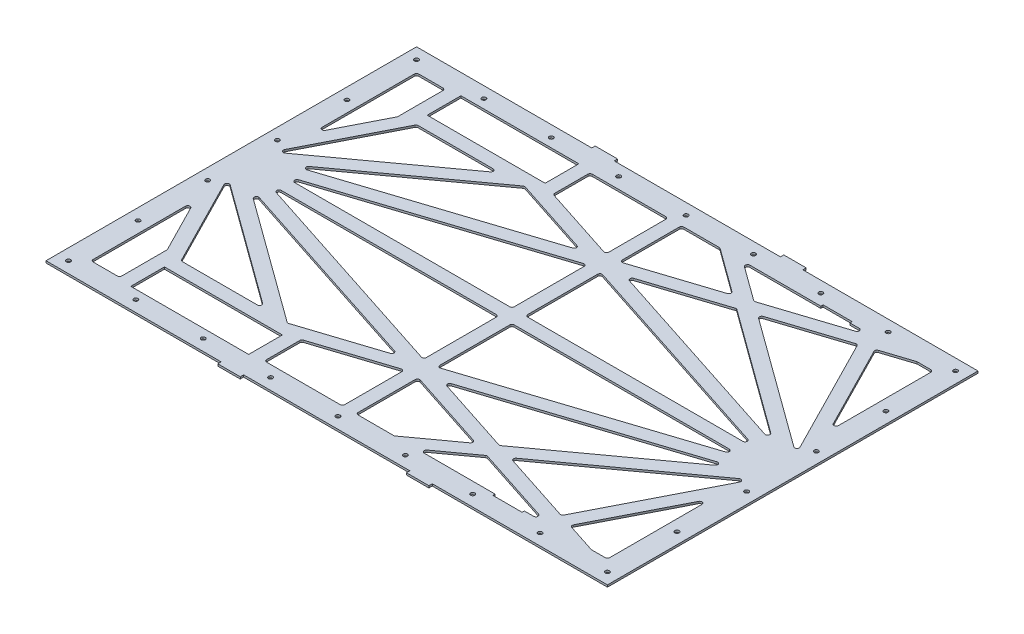
from build123d import *

# Parameters (mm, degrees)
SKETCH1_W               = 635
SKETCH1_H               = 419.1
BOSS_EXTRUDE1_DEPTH     = 2.286
SKETCH2_W               = 133.35
SKETCH2_H               = 38.1
CUT_EXTRUDE1_DEPTH      = 381.424339779
CUT_EXTRUDE2_DEPTH      = 381.424339779
SKETCH5_W               = 33.02
SKETCH5_H               = 2.54
CUT_EXTRUDE3_DEPTH      = 2.54
SKETCH8_W               = 25.4
SKETCH8_H               = 3.81
BOSS_EXTRUDE3_DEPTH     = 2.286
MIRROR5_COPY_1_SKETCH_W = 25.4
MIRROR5_COPY_1_SKETCH_H = 3.81
MIRROR5_COPY_1_DEPTH    = 2.286
SKETCH9_R               = 2.38125
CUT_EXTRUDE5_DEPTH      = 2.54
LPATTERN1_COUNT         = 9
LPATTERN1_PITCH         = 76.2
LPATTERN2_COUNT         = 9
LPATTERN2_PITCH         = 78.74
MIRROR6_COPY_1_SKETCH_R = 2.38125
MIRROR6_COPY_1_DEPTH    = 2.54
MIRROR6_COPY_2_SKETCH_R = 2.38125
MIRROR6_COPY_2_DEPTH    = 2.54
MIRROR6_COPY_3_SKETCH_R = 2.38125
MIRROR6_COPY_3_DEPTH    = 2.54
MIRROR6_COPY_4_SKETCH_R = 2.38125
MIRROR6_COPY_4_DEPTH    = 2.54
MIRROR6_COPY_5_SKETCH_R = 2.38125
MIRROR6_COPY_5_DEPTH    = 2.54
MIRROR6_COPY_6_SKETCH_R = 2.38125
MIRROR6_COPY_6_DEPTH    = 2.54
MIRROR6_COPY_7_SKETCH_R = 2.38125
MIRROR6_COPY_7_DEPTH    = 2.54
MIRROR6_COPY_8_SKETCH_R = 2.38125
MIRROR6_COPY_8_DEPTH    = 2.54
MIRROR6_COPY_9_SKETCH_R = 2.38125
MIRROR6_COPY_9_DEPTH    = 2.54
MIRROR7_COPY_1_SKETCH_R = 2.38125
MIRROR7_COPY_1_DEPTH    = 2.54
MIRROR7_COPY_2_SKETCH_R = 2.38125
MIRROR7_COPY_2_DEPTH    = 2.54
MIRROR7_COPY_3_SKETCH_R = 2.38125
MIRROR7_COPY_3_DEPTH    = 2.54
MIRROR7_COPY_4_SKETCH_R = 2.38125
MIRROR7_COPY_4_DEPTH    = 2.54
MIRROR7_COPY_5_SKETCH_R = 2.38125
MIRROR7_COPY_5_DEPTH    = 2.54
MIRROR7_COPY_6_SKETCH_R = 2.38125
MIRROR7_COPY_6_DEPTH    = 2.54
MIRROR7_COPY_7_SKETCH_R = 2.38125
MIRROR7_COPY_7_DEPTH    = 2.54
MIRROR7_COPY_8_SKETCH_R = 2.38125
MIRROR7_COPY_8_DEPTH    = 2.54
MIRROR7_COPY_9_SKETCH_R = 2.38125
MIRROR7_COPY_9_DEPTH    = 2.54


with BuildPart() as part:
    # Sketch1 → Boss-Extrude1 (new body)
    with BuildSketch(Plane(origin=(0, 0, 0), x_dir=(1, 0, 0), z_dir=(0, 1, 0))):
        Rectangle(SKETCH1_W, SKETCH1_H)
    extrude(amount=BOSS_EXTRUDE1_DEPTH)

    # Sketch2 → Cut-Extrude1 (cut, through all)
    with BuildSketch(Plane(origin=(0, 2.286, 0), x_dir=(1, 0, 0), z_dir=(0, 1, 0))):
        with Locations((-177.8, -167.64)):
            Rectangle(SKETCH2_W, SKETCH2_H)
        with Locations((-177.8, 167.64)):
            Rectangle(SKETCH2_W, SKETCH2_H)
    extrude(amount=-CUT_EXTRUDE1_DEPTH, mode=Mode.SUBTRACT)

    # Sketch4 → Cut-Extrude2 (cut, through all)
    with BuildSketch(Plane(origin=(0, 2.286, 0), x_dir=(1, 0, 0), z_dir=(0, 1, 0))):
        with BuildLine():
            Line((-289.56, -184.15), (-262.255, -184.15))
            ThreePointArc((-262.255, -184.15), (-260.458948776, -183.406051224), (-259.715, -181.61))
            Line((-259.715, -181.61), (-259.715, -130.803740305))
            ThreePointArc((-259.715, -130.803740305), (-259.785180402, -130.210789081), (-259.991843429, -129.650604435))
            Line((-259.991843429, -129.650604435), (-287.296843429, -76.061524583))
            ThreePointArc((-287.296843429, -76.061524583), (-290.152951224, -74.744840854), (-292.1, -77.214660452))
            Line((-292.1, -77.214660452), (-292.1, -181.61))
            ThreePointArc((-292.1, -181.61), (-291.356051224, -183.406051224), (-289.56, -184.15))
        make_face()
        with BuildLine():
            Line((-154.740705409, -133.35), (-239.446141377, -133.35))
            ThreePointArc((-239.446141377, -133.35), (-240.773287732, -132.975706017), (-241.709297949, -131.963135869))
            Line((-241.709297949, -131.963135869), (-291.497904, -34.247494579))
            ThreePointArc((-291.497904, -34.247494579), (-290.884345471, -31.162927557), (-287.741772888, -31.039455544))
            Line((-287.741772888, -31.039455544), (-153.247730868, -128.755096834))
            ThreePointArc((-153.247730868, -128.755096834), (-152.325021857, -131.594903166), (-154.740705409, -133.35))
        make_face()
        with BuildLine():
            Line((-32.093547486, -105.577687105), (-118.70550908, -133.719619357))
            ThreePointArc((-118.70550908, -133.719619357), (-119.887755787, -133.81266419), (-120.983386786, -133.358838971))
            Line((-120.983386786, -133.358838971), (-261.124484477, -31.540371577))
            ThreePointArc((-261.124484477, -31.540371577), (-261.894666508, -28.332332542), (-258.846606771, -27.06978486))
            Line((-258.846606771, -27.06978486), (-32.093547486, -100.746320003))
            ThreePointArc((-32.093547486, -100.746320003), (-30.338450651, -103.162003554), (-32.093547486, -105.577687105))
        make_face()
        with BuildLine():
            Line((-7.62, -10.16), (-7.62, -89.177963242))
            ThreePointArc((-7.62, -89.177963242), (-8.667025459, -91.232866408), (-10.944903166, -91.593646793))
            Line((-10.944903166, -91.593646793), (-254.137187777, -12.575683551))
            ThreePointArc((-254.137187777, -12.575683551), (-255.861012996, -9.762656459), (-253.352284611, -7.62))
            Line((-253.352284611, -7.62), (-10.16, -7.62))
            ThreePointArc((-10.16, -7.62), (-8.363948776, -8.363948776), (-7.62, -10.16))
        make_face()
        with BuildLine():
            Line((-93.345, -184.15), (-10.16, -184.15))
            ThreePointArc((-10.16, -184.15), (-8.363948776, -183.406051224), (-7.62, -181.61))
            Line((-7.62, -181.61), (-7.62, -117.146043866))
            ThreePointArc((-7.62, -117.146043866), (-8.667025459, -115.0911407), (-10.944903166, -114.730360315))
            Line((-10.944903166, -114.730360315), (-94.129903166, -141.758805246))
            ThreePointArc((-94.129903166, -141.758805246), (-95.399903166, -142.681514256), (-95.885, -144.174488797))
            Line((-95.885, -144.174488797), (-95.885, -181.61))
            ThreePointArc((-95.885, -181.61), (-95.141051224, -183.406051224), (-93.345, -184.15))
        make_face()
        with BuildLine():
            Line((254.137187777, -12.575683551), (10.944903166, -91.593646793))
            ThreePointArc((10.944903166, -91.593646793), (8.667025459, -91.232866408), (7.62, -89.177963242))
            Line((7.62, -89.177963242), (7.62, -10.16))
            ThreePointArc((7.62, -10.16), (8.363948776, -8.363948776), (10.16, -7.62))
            Line((10.16, -7.62), (253.352284611, -7.62))
            ThreePointArc((253.352284611, -7.62), (255.861012996, -9.762656459), (254.137187777, -12.575683551))
        make_face()
        with BuildLine():
            Line((261.124484477, -31.540371577), (120.983386786, -133.358838971))
            ThreePointArc((120.983386786, -133.358838971), (119.887755787, -133.81266419), (118.70550908, -133.719619357))
            Line((118.70550908, -133.719619357), (32.093547486, -105.577687105))
            ThreePointArc((32.093547486, -105.577687105), (30.338450651, -103.162003554), (32.093547486, -100.746320003))
            Line((32.093547486, -100.746320003), (258.846606771, -27.06978486))
            ThreePointArc((258.846606771, -27.06978486), (261.894666508, -28.332332542), (261.124484477, -31.540371577))
        make_face()
        with BuildLine():
            Line((287.741772888, -31.039455544), (141.885030358, -137.010581988))
            ThreePointArc((141.885030358, -137.010581988), (140.869276513, -139.462828695), (142.593101733, -141.481168705))
            Line((142.593101733, -141.481168705), (221.406858424, -167.089310588))
            ThreePointArc((221.406858424, -167.089310588), (223.163777508, -167.020281049), (224.454918161, -165.826762906))
            Line((224.454918161, -165.826762906), (291.497904, -34.247494579))
            ThreePointArc((291.497904, -34.247494579), (290.884345471, -31.162927557), (287.741772888, -31.039455544))
        make_face()
        with BuildLine():
            Line((121.565030358, -151.773926157), (83.327529308, -179.555096834))
            ThreePointArc((83.327529308, -179.555096834), (82.404820298, -182.394903166), (84.820503849, -184.15))
            Line((84.820503849, -184.15), (208.559656535, -184.15))
            ThreePointArc((208.559656535, -184.15), (211.06838492, -182.007343541), (209.344559701, -179.194316449))
            Line((209.344559701, -179.194316449), (123.842908064, -151.413145771))
            ThreePointArc((123.842908064, -151.413145771), (122.660661357, -151.320100938), (121.565030358, -151.773926157))
        make_face()
        with BuildLine():
            Line((10.944903166, -114.730360315), (99.955315411, -143.651596423))
            ThreePointArc((99.955315411, -143.651596423), (101.67914063, -145.669936433), (100.663386786, -148.12218314))
            Line((100.663386786, -148.12218314), (51.743029538, -183.664903166))
            ThreePointArc((51.743029538, -183.664903166), (51.034958163, -184.025683551), (50.250054998, -184.15))
            Line((50.250054998, -184.15), (10.16, -184.15))
            ThreePointArc((10.16, -184.15), (8.363948776, -183.406051224), (7.62, -181.61))
            Line((7.62, -181.61), (7.62, -117.146043866))
            ThreePointArc((7.62, -117.146043866), (8.667025459, -115.0911407), (10.944903166, -114.730360315))
        make_face()
        with BuildLine():
            Line((292.1, -181.61), (292.1, -77.214660452))
            ThreePointArc((292.1, -77.214660452), (290.152951224, -74.744840854), (287.296843429, -76.061524583))
            Line((287.296843429, -76.061524583), (239.494967824, -169.877987827))
            ThreePointArc((239.494967824, -169.877987827), (239.411470383, -172.003139614), (240.97322123, -173.446807248))
            Line((240.97322123, -173.446807248), (273.531654672, -184.025683551))
            ThreePointArc((273.531654672, -184.025683551), (273.919214297, -184.118728385), (274.316557838, -184.15))
            Line((274.316557838, -184.15), (289.56, -184.15))
            ThreePointArc((289.56, -184.15), (291.356051224, -183.406051224), (292.1, -181.61))
        make_face()
    cut_extrude2 = extrude(amount=-CUT_EXTRUDE2_DEPTH, mode=Mode.SUBTRACT)

    # Sketch5 → Cut-Extrude3 (cut)
    with BuildSketch(Plane(origin=(0, 2.286, 0), x_dir=(1, 0, 0), z_dir=(0, 1, 0))):
        with Locations((181.61, -185.42)):
            Rectangle(SKETCH5_W, SKETCH5_H)
    cut_extrude3 = extrude(amount=-CUT_EXTRUDE3_DEPTH, mode=Mode.SUBTRACT)

    # Mirror1: Cut-Extrude2, Cut-Extrude3 across plane
    add(cut_extrude2.mirror(Plane.XY), mode=Mode.SUBTRACT)
    add(cut_extrude3.mirror(Plane.XY), mode=Mode.SUBTRACT)

    # Sketch8 → Boss-Extrude3 (add)
    with BuildSketch(Plane(origin=(0, 2.286, 0), x_dir=(1, 0, 0), z_dir=(0, 1, 0))):
        with Locations((-106.68, 211.455)):
            Rectangle(SKETCH8_W, SKETCH8_H)
    boss_extrude3 = extrude(amount=-BOSS_EXTRUDE3_DEPTH)

    # Mirror4: Boss-Extrude3 across plane
    add(boss_extrude3.mirror(Plane(origin=(0, 0, 0), x_dir=(0, 0, 1), z_dir=(1, 0, 0))))

    # Mirror5: Boss-Extrude3 across plane
    add(boss_extrude3.mirror(Plane.XY))

    # Mirror5 copy 1 sketch → Mirror5 copy 1 (add)
    with BuildSketch(Plane(origin=(0, 2.286, 0), x_dir=(-1, 0, 0), z_dir=(0, 1, 0))):
        with Locations((-106.68, 211.455)):
            Rectangle(MIRROR5_COPY_1_SKETCH_W, MIRROR5_COPY_1_SKETCH_H)
    extrude(amount=-MIRROR5_COPY_1_DEPTH)

    # Sketch9 → Cut-Extrude5 (cut)
    with BuildSketch(Plane(origin=(0, 2.286, 0), x_dir=(1, 0, 0), z_dir=(0, 1, 0))):
        with Locations(Location((-304.8, -196.85, 0), (0, 0, 270))):
            Circle(SKETCH9_R)
    cut_extrude5 = extrude(amount=-CUT_EXTRUDE5_DEPTH, mode=Mode.SUBTRACT)

    # LPattern1: Cut-Extrude5 ×9
    with Locations(*[(i * LPATTERN1_PITCH, 0, 0) for i in range(1, LPATTERN1_COUNT)]):
        add(cut_extrude5, mode=Mode.SUBTRACT)

    # LPattern2: Cut-Extrude5 ×9
    with Locations(*[(0, 0, -i * LPATTERN2_PITCH) for i in range(1, LPATTERN2_COUNT)]):
        add(cut_extrude5, mode=Mode.SUBTRACT)

    # Mirror6 copy 1 sketch → Mirror6 copy 1 (cut)
    with BuildSketch(Plane(origin=(0, 2.286, -78.74), x_dir=(-1, 0, 0), z_dir=(0, 1, 0))):
        with Locations((-304.8, 196.85)):
            Circle(MIRROR6_COPY_1_SKETCH_R)
    extrude(amount=-MIRROR6_COPY_1_DEPTH, mode=Mode.SUBTRACT)

    # Mirror6 copy 2 sketch → Mirror6 copy 2 (cut)
    with BuildSketch(Plane(origin=(0, 2.286, -157.48), x_dir=(-1, 0, 0), z_dir=(0, 1, 0))):
        with Locations((-304.8, 196.85)):
            Circle(MIRROR6_COPY_2_SKETCH_R)
    extrude(amount=-MIRROR6_COPY_2_DEPTH, mode=Mode.SUBTRACT)

    # Mirror6 copy 3 sketch → Mirror6 copy 3 (cut)
    with BuildSketch(Plane(origin=(0, 2.286, -236.22), x_dir=(-1, 0, 0), z_dir=(0, 1, 0))):
        with Locations((-304.8, 196.85)):
            Circle(MIRROR6_COPY_3_SKETCH_R)
    extrude(amount=-MIRROR6_COPY_3_DEPTH, mode=Mode.SUBTRACT)

    # Mirror6 copy 4 sketch → Mirror6 copy 4 (cut)
    with BuildSketch(Plane(origin=(0, 2.286, -314.96), x_dir=(-1, 0, 0), z_dir=(0, 1, 0))):
        with Locations((-304.8, 196.85)):
            Circle(MIRROR6_COPY_4_SKETCH_R)
    extrude(amount=-MIRROR6_COPY_4_DEPTH, mode=Mode.SUBTRACT)

    # Mirror6 copy 5 sketch → Mirror6 copy 5 (cut)
    with BuildSketch(Plane(origin=(0, 2.286, -393.7), x_dir=(-1, 0, 0), z_dir=(0, 1, 0))):
        with Locations((-304.8, 196.85)):
            Circle(MIRROR6_COPY_5_SKETCH_R)
    extrude(amount=-MIRROR6_COPY_5_DEPTH, mode=Mode.SUBTRACT)

    # Mirror6 copy 6 sketch → Mirror6 copy 6 (cut)
    with BuildSketch(Plane(origin=(0, 2.286, -472.44), x_dir=(-1, 0, 0), z_dir=(0, 1, 0))):
        with Locations((-304.8, 196.85)):
            Circle(MIRROR6_COPY_6_SKETCH_R)
    extrude(amount=-MIRROR6_COPY_6_DEPTH, mode=Mode.SUBTRACT)

    # Mirror6 copy 7 sketch → Mirror6 copy 7 (cut)
    with BuildSketch(Plane(origin=(0, 2.286, -551.18), x_dir=(-1, 0, 0), z_dir=(0, 1, 0))):
        with Locations((-304.8, 196.85)):
            Circle(MIRROR6_COPY_7_SKETCH_R)
    extrude(amount=-MIRROR6_COPY_7_DEPTH, mode=Mode.SUBTRACT)

    # Mirror6 copy 8 sketch → Mirror6 copy 8 (cut)
    with BuildSketch(Plane(origin=(0, 2.286, -629.92), x_dir=(-1, 0, 0), z_dir=(0, 1, 0))):
        with Locations((-304.8, 196.85)):
            Circle(MIRROR6_COPY_8_SKETCH_R)
    extrude(amount=-MIRROR6_COPY_8_DEPTH, mode=Mode.SUBTRACT)

    # Mirror6 copy 9 sketch → Mirror6 copy 9 (cut)
    with BuildSketch(Plane(origin=(0, 2.286, 0), x_dir=(-1, 0, 0), z_dir=(0, 1, 0))):
        with Locations((-304.8, 196.85)):
            Circle(MIRROR6_COPY_9_SKETCH_R)
    extrude(amount=-MIRROR6_COPY_9_DEPTH, mode=Mode.SUBTRACT)

    # Mirror7 copy 1 sketch → Mirror7 copy 1 (cut)
    with BuildSketch(Plane(origin=(76.2, 2.286, 0), x_dir=(1, 0, 0), z_dir=(0, 1, 0))):
        with Locations((-304.8, 196.85)):
            Circle(MIRROR7_COPY_1_SKETCH_R)
    extrude(amount=-MIRROR7_COPY_1_DEPTH, mode=Mode.SUBTRACT)

    # Mirror7 copy 2 sketch → Mirror7 copy 2 (cut)
    with BuildSketch(Plane(origin=(152.4, 2.286, 0), x_dir=(1, 0, 0), z_dir=(0, 1, 0))):
        with Locations((-304.8, 196.85)):
            Circle(MIRROR7_COPY_2_SKETCH_R)
    extrude(amount=-MIRROR7_COPY_2_DEPTH, mode=Mode.SUBTRACT)

    # Mirror7 copy 3 sketch → Mirror7 copy 3 (cut)
    with BuildSketch(Plane(origin=(228.6, 2.286, 0), x_dir=(1, 0, 0), z_dir=(0, 1, 0))):
        with Locations((-304.8, 196.85)):
            Circle(MIRROR7_COPY_3_SKETCH_R)
    extrude(amount=-MIRROR7_COPY_3_DEPTH, mode=Mode.SUBTRACT)

    # Mirror7 copy 4 sketch → Mirror7 copy 4 (cut)
    with BuildSketch(Plane(origin=(304.8, 2.286, 0), x_dir=(1, 0, 0), z_dir=(0, 1, 0))):
        with Locations((-304.8, 196.85)):
            Circle(MIRROR7_COPY_4_SKETCH_R)
    extrude(amount=-MIRROR7_COPY_4_DEPTH, mode=Mode.SUBTRACT)

    # Mirror7 copy 5 sketch → Mirror7 copy 5 (cut)
    with BuildSketch(Plane(origin=(381, 2.286, 0), x_dir=(1, 0, 0), z_dir=(0, 1, 0))):
        with Locations((-304.8, 196.85)):
            Circle(MIRROR7_COPY_5_SKETCH_R)
    extrude(amount=-MIRROR7_COPY_5_DEPTH, mode=Mode.SUBTRACT)

    # Mirror7 copy 6 sketch → Mirror7 copy 6 (cut)
    with BuildSketch(Plane(origin=(457.2, 2.286, 0), x_dir=(1, 0, 0), z_dir=(0, 1, 0))):
        with Locations((-304.8, 196.85)):
            Circle(MIRROR7_COPY_6_SKETCH_R)
    extrude(amount=-MIRROR7_COPY_6_DEPTH, mode=Mode.SUBTRACT)

    # Mirror7 copy 7 sketch → Mirror7 copy 7 (cut)
    with BuildSketch(Plane(origin=(533.4, 2.286, 0), x_dir=(1, 0, 0), z_dir=(0, 1, 0))):
        with Locations((-304.8, 196.85)):
            Circle(MIRROR7_COPY_7_SKETCH_R)
    extrude(amount=-MIRROR7_COPY_7_DEPTH, mode=Mode.SUBTRACT)

    # Mirror7 copy 8 sketch → Mirror7 copy 8 (cut)
    with BuildSketch(Plane(origin=(609.6, 2.286, 0), x_dir=(1, 0, 0), z_dir=(0, 1, 0))):
        with Locations((-304.8, 196.85)):
            Circle(MIRROR7_COPY_8_SKETCH_R)
    extrude(amount=-MIRROR7_COPY_8_DEPTH, mode=Mode.SUBTRACT)

    # Mirror7 copy 9 sketch → Mirror7 copy 9 (cut)
    with BuildSketch(Plane(origin=(0, 2.286, 0), x_dir=(1, 0, 0), z_dir=(0, 1, 0))):
        with Locations((-304.8, 196.85)):
            Circle(MIRROR7_COPY_9_SKETCH_R)
    extrude(amount=-MIRROR7_COPY_9_DEPTH, mode=Mode.SUBTRACT)


solid = part.part
